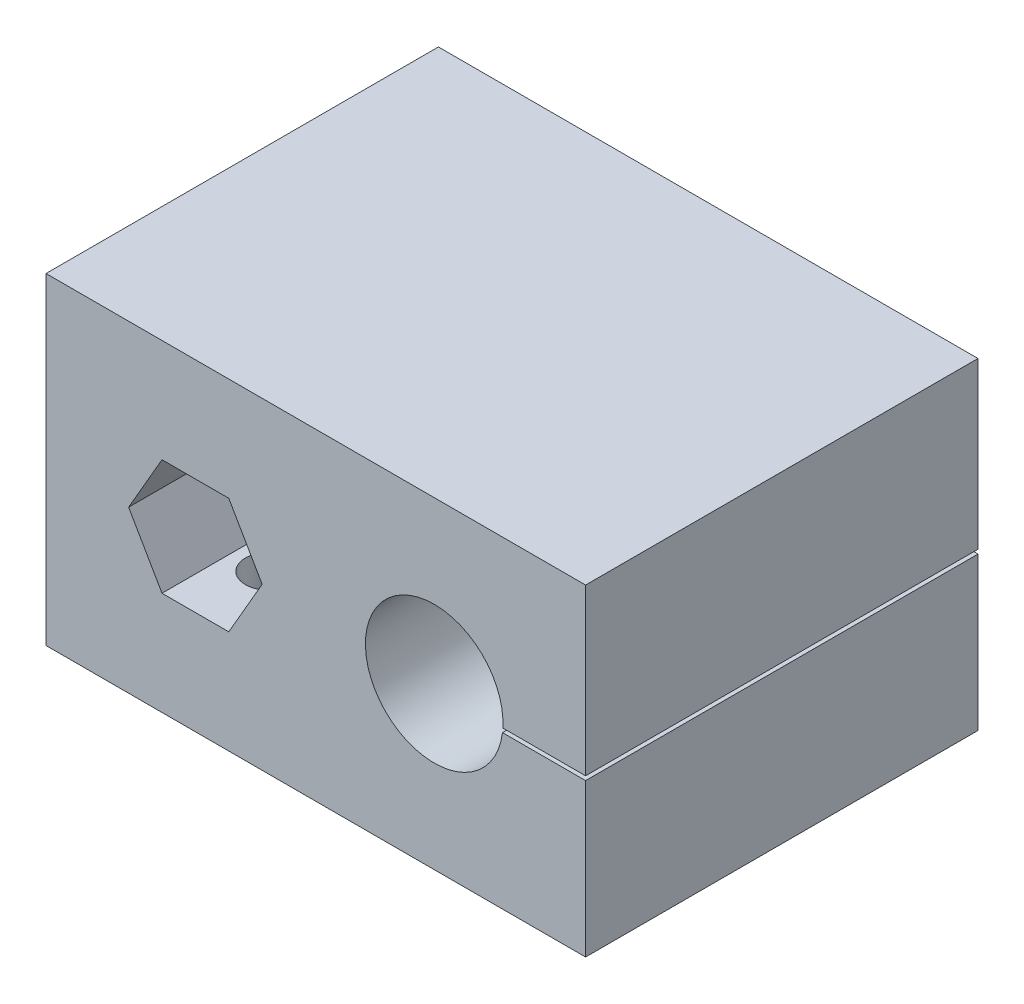
from build123d import *

# Parameters (mm, degrees)
SKETCH2_W               = 33.180430229
SKETCH2_H               = 19.812
SKETCH2_R               = 4.2291
BOSS_EXTRUDE3_DEPTH     = 12.065
CUT_EXTRUDE5_REACH      = 24.87
SKETCH7_R               = 1.4224
CUT_EXTRUDE8_DEPTH      = 23.86983051
CUT_EXTRUDE8_DEPTH_BACK = 23.86983051
SKETCH8_W               = 12.7
SKETCH8_H               = 0.254


with BuildPart() as part:
    # Sketch2 → Boss-Extrude3 (new, symmetric)
    with BuildSketch(Plane.XY):
        with Locations((0.122984885, 0.000254)):
            Rectangle(SKETCH2_W, SKETCH2_H)
        with Locations((7.4041, 0.000254)):
            Circle(SKETCH2_R, mode=Mode.SUBTRACT)
        Polygon((-11.387230229, 0.000254), (-9.334172672, -3.555746), (-5.228057557, -3.555746), (-3.175, 0.000254), (-5.228057557, 3.556254), (-9.334172672, 3.556254), align=None, mode=Mode.SUBTRACT)
    extrude(amount=BOSS_EXTRUDE3_DEPTH, both=True)

    # Sketch7 → Cut-Extrude5 (cut, up to next)
    with BuildSketch(Plane(origin=(0, 0, 0), x_dir=(1, 0, 0), z_dir=(0, 1, 0)), mode=Mode.PRIVATE) as cut_extrude5_sk1:
        with Locations((-7.228125784, -7.62)):
            Circle(SKETCH7_R)
    cut_extrude5_tool1 = extrude(cut_extrude5_sk1.sketch, amount=-CUT_EXTRUDE5_REACH, mode=Mode.PRIVATE) & part.part
    # Sketch7 → Cut-Extrude5 (cut, up to next)
    with BuildSketch(Plane(origin=(0, 0, 0), x_dir=(1, 0, 0), z_dir=(0, 1, 0)), mode=Mode.PRIVATE) as cut_extrude5_sk2:
        with Locations((-7.228125784, 7.62)):
            Circle(SKETCH7_R)
    cut_extrude5_tool2 = extrude(cut_extrude5_sk2.sketch, amount=-CUT_EXTRUDE5_REACH, mode=Mode.PRIVATE) & part.part
    add(cut_extrude5_tool1.solids().sort_by_distance((-7.228126, 0, 7.62))[0], mode=Mode.SUBTRACT)
    add(cut_extrude5_tool2.solids().sort_by_distance((-7.228126, 0, -7.62))[0], mode=Mode.SUBTRACT)

    # Sketch8 → Cut-Extrude8 (cut, two sides: drawn at the far end of the back side and taken through both)
    with BuildSketch(Plane.XY.offset(-CUT_EXTRUDE8_DEPTH_BACK)):
        with Locations((13.86896495, -0.381)):
            Rectangle(SKETCH8_W, SKETCH8_H)
    extrude(amount=CUT_EXTRUDE8_DEPTH + CUT_EXTRUDE8_DEPTH_BACK, mode=Mode.SUBTRACT)


solid = part.part
